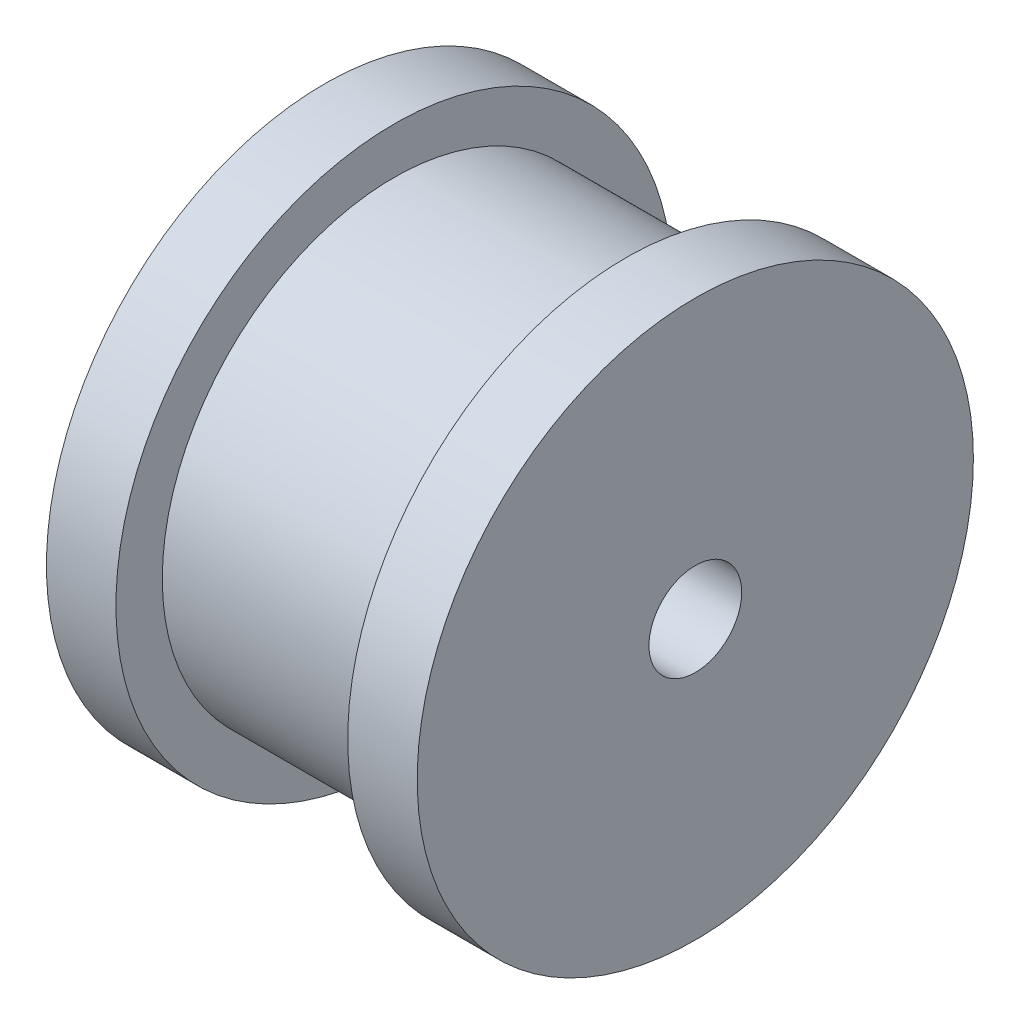
from build123d import *

# Parameters (mm, degrees)
SKETCH_2_R               = 12
EXTRUDE_1_DEPTH          = 8
SKETCH_3_R               = 12
SKETCH_3_R_2             = 10
CUT_EXTRUDE_1_DEPTH      = 5
CUT_EXTRUDE_2_DEPTH      = 19.761663039
CUT_EXTRUDE_2_DEPTH_BACK = 19.761663039
SKETCH_4_R               = 2


with BuildPart() as part:
    # 草图2 → 凸台-拉伸1 (new, symmetric)
    with BuildSketch(Plane(origin=(0, 0, 0), x_dir=(0, 0, -1), z_dir=(1, 0, 0))):
        Circle(SKETCH_2_R)
    extrude(amount=EXTRUDE_1_DEPTH, both=True)

    # 草图3 → 切除-拉伸1 (cut, symmetric)
    with BuildSketch(Plane(origin=(0, 0, 0), x_dir=(0, 0, -1), z_dir=(1, 0, 0))):
        Circle(SKETCH_3_R)
        Circle(SKETCH_3_R_2, mode=Mode.SUBTRACT)
    extrude(amount=CUT_EXTRUDE_1_DEPTH, both=True, mode=Mode.SUBTRACT)

    # 草图4 → 切除-拉伸2 (cut, two sides: drawn at the far end of the back side and taken through both)
    with BuildSketch(Plane(origin=(0, 0, 0), x_dir=(0, 0, -1), z_dir=(1, 0, 0)).offset(-CUT_EXTRUDE_2_DEPTH_BACK)):
        Circle(SKETCH_4_R)
    extrude(amount=CUT_EXTRUDE_2_DEPTH + CUT_EXTRUDE_2_DEPTH_BACK, mode=Mode.SUBTRACT)


solid = part.part
